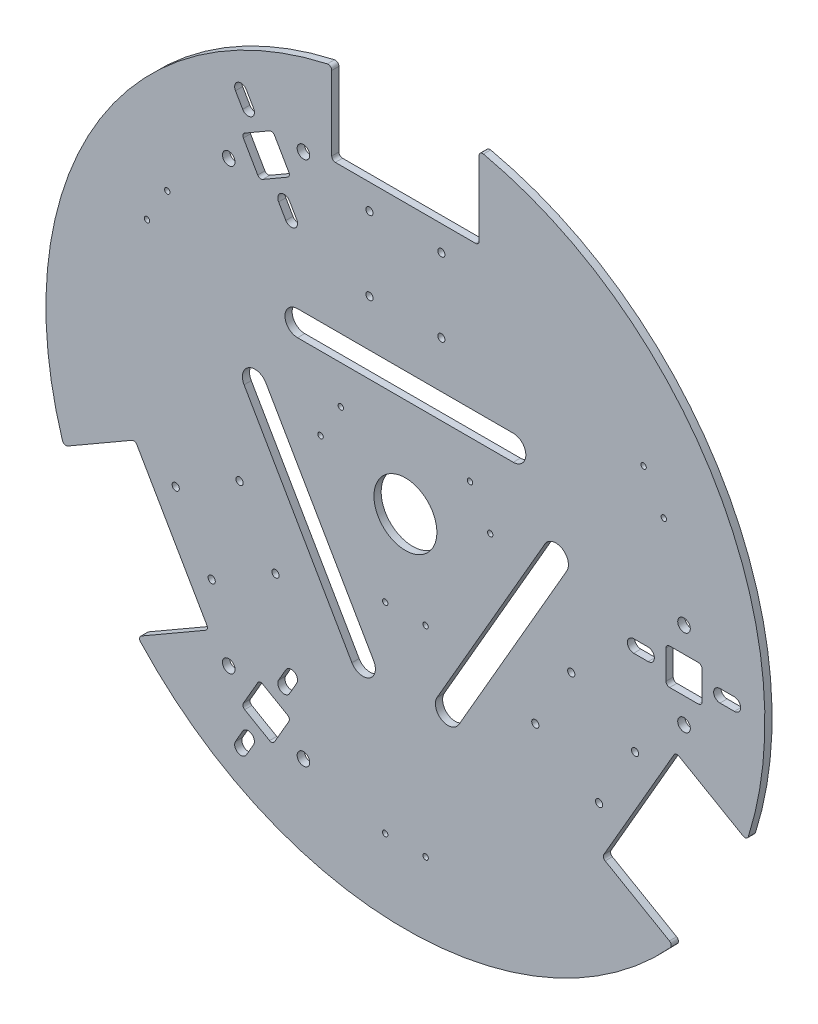
from build123d import *

# Parameters (mm, degrees)
SKETCH1_R                = 200
BOSS_EXTRUDE2_DEPTH      = 4
CUT_EXTRUDE3_DEPTH       = 4
SKETCH4_R                = 17.500000000000004
CUT_EXTRUDE4_DEPTH       = 4
SKETCH5_R                = 2
CUT_EXTRUDE5_DEPTH       = 4
SKETCH6_R                = 1.4999999999999973
SKETCH6_R_2              = 1.5000000000000042
CUT_EXTRUDE6_DEPTH       = 4
CIRPATTERN2_COUNT        = 3
CIRPATTERN3_COUNT        = 3
CUT_EXTRUDE7_DEPTH       = 4
CIRPATTERN4_COUNT        = 3
SKETCH9_R                = 3.500000000000001
SKETCH9_R_2              = 3.5000000000000075
CUT_EXTRUDE8_DEPTH       = 4
CIRPATTERN6_COUNT        = 3
FILLET1_R                = 2
FILLET2_R                = 2
CIRPATTERN7_COUNT        = 3
FILLET2_OF_CIRPATTERN7_R = 2


with BuildPart() as part:
    # Sketch1 → Boss-Extrude2 (new body)
    with BuildSketch(Plane.XY):
        Circle(SKETCH1_R)
    extrude(amount=BOSS_EXTRUDE2_DEPTH)

    # Sketch3 → Cut-Extrude3 (cut)
    with BuildSketch(Plane.XY):
        with BuildLine():
            Line((-41.00000000000001, 195.75239462136855), (-41, 150.00000000000003))
            Line((-41, 150.00000000000003), (41, 150.00000000000003))
            Line((41, 150.00000000000003), (41.00000000000001, 195.75239462136855))
            ThreePointArc((41.00000000000001, 195.75239462136855), (1.225e-14, 200), (-41.00000000000001, 195.75239462136855))
        make_face()
    cut_extrude3 = extrude(amount=CUT_EXTRUDE3_DEPTH, mode=Mode.SUBTRACT)

    # Sketch4 → Cut-Extrude4 (cut)
    with BuildSketch(Plane.XY):
        with Locations(Location((0, 0, 0), (0, 0, 180))):
            Circle(SKETCH4_R)
    extrude(amount=CUT_EXTRUDE4_DEPTH, mode=Mode.SUBTRACT)

    # Sketch5 → Cut-Extrude5 (cut)
    with BuildSketch(Plane.XY):
        with Locations(Location((-20, 136, 0), (0, 0, 180))):
            Circle(SKETCH5_R)
        with Locations(Location((-20, 95, 0), (0, 0, 180))):
            Circle(SKETCH5_R)
        with Locations(Location((20, 136, 0), (0, 0, 180))):
            Circle(SKETCH5_R)
        with Locations(Location((20, 95, 0), (0, 0, 180))):
            Circle(SKETCH5_R)
    cut_extrude5 = extrude(amount=CUT_EXTRUDE5_DEPTH, mode=Mode.SUBTRACT)

    # Sketch6 → Cut-Extrude6 (cut)
    with BuildSketch(Plane.XY):
        with Locations((-143.75605190361796, 70.00721420742511)):
            Circle(SKETCH6_R)
        with Locations((-132.50605190361796, 89.49278579257494)):
            Circle(SKETCH6_R)
        with Locations((-35.94421938165304, 33.742785792574935)):
            Circle(SKETCH6_R_2)
        with Locations((-47.19421938165304, 14.257214207425067)):
            Circle(SKETCH6_R_2)
    cut_extrude6 = extrude(amount=CUT_EXTRUDE6_DEPTH, mode=Mode.SUBTRACT)

    # CirPattern2: Cut-Extrude6 ×3 about axis
    cirpattern2_axis = Axis((9.38e-15, 1.23e-15, 0), (0, 0, 1))
    for i in range(1, CIRPATTERN2_COUNT):
        add(cut_extrude6.rotate(cirpattern2_axis, i * 360 / CIRPATTERN2_COUNT), mode=Mode.SUBTRACT)

    # CirPattern3: Cut-Extrude5 ×3 about axis
    cirpattern3_axis = Axis((6.55e-15, -6.68e-15, 0), (0, 0, 1))
    for i in range(1, CIRPATTERN3_COUNT):
        add(cut_extrude5.rotate(cirpattern3_axis, i * 360 / CIRPATTERN3_COUNT), mode=Mode.SUBTRACT)

    # Sketch8 → Cut-Extrude7 (cut)
    with BuildSketch(Plane.XY):
        with BuildLine():
            Line((-60, 69), (60, 69.00000000000003))
            ThreePointArc((60, 69.00000000000003), (66.99999999999997, 62), (60, 55.00000000000002))
            Line((60, 55.00000000000002), (-60, 55))
            ThreePointArc((-60, 55), (-67, 62), (-60, 69))
        make_face()
    cut_extrude7 = extrude(amount=CUT_EXTRUDE7_DEPTH, mode=Mode.SUBTRACT)

    # CirPattern4: Cut-Extrude7 ×3 about axis
    cirpattern4_axis = Axis((2.08e-15, -4.82e-15, 0), (0, 0, 1))
    for i in range(1, CIRPATTERN4_COUNT):
        add(cut_extrude7.rotate(cirpattern4_axis, i * 360 / CIRPATTERN4_COUNT), mode=Mode.SUBTRACT)

    # Sketch9 → Cut-Extrude8 (cut)
    with BuildSketch(Plane.XY.offset(4)):
        with Locations((-56.71539030917355, 146.233937586588)):
            Circle(SKETCH9_R)
        with Locations((-98.28460969082658, 122.23393758658793)):
            Circle(SKETCH9_R_2)
        Polygon((-91.16025403784447, 137.89419162443235), (-81.16025403784445, 120.57368354874356), (-63.83974596215569, 130.57368354874362), (-73.8397459621557, 147.89419162443235), align=None)
        with BuildLine():
            Line((-64.46891108675452, 118.66342951089922), (-60.46891108675456, 111.73522628062365))
            ThreePointArc((-60.46891108675456, 111.73522628062365), (-61.75000000000001, 106.9541373673781), (-66.53108891324563, 108.23522628062368))
            Line((-66.53108891324563, 108.23522628062368), (-70.53108891324557, 115.1634295108992))
            ThreePointArc((-70.53108891324557, 115.1634295108992), (-69.25000000000003, 119.94451842414472), (-64.46891108675452, 118.66342951089922))
        make_face()
        with BuildLine():
            Line((-84.46891108675456, 153.30444566227675), (-88.46891108675459, 160.23264889255222))
            ThreePointArc((-88.46891108675459, 160.23264889255222), (-93.25000000000009, 161.5137378057978), (-94.53108891324563, 156.73264889255222))
            Line((-94.53108891324563, 156.73264889255222), (-90.53108891324563, 149.80444566227675))
            ThreePointArc((-90.53108891324563, 149.80444566227675), (-85.7500000000001, 148.52335674903122), (-84.46891108675456, 153.30444566227675))
        make_face()
    cut_extrude8 = extrude(amount=-CUT_EXTRUDE8_DEPTH, mode=Mode.SUBTRACT)

    # CirPattern6: Cut-Extrude3 ×3 about axis
    cirpattern6_axis = Axis((-9.9e-16, -1.19e-14, 0), (0, 0, 1))
    for i in range(1, CIRPATTERN6_COUNT):
        add(cut_extrude3.rotate(cirpattern6_axis, i * 360 / CIRPATTERN6_COUNT), mode=Mode.SUBTRACT)

    # Fillet1
    fillet1_edges = [part.edges().sort_by_distance(p)[0] for p in [
        (41.00000000000001, 195.75239462136855, 2),
        (-41.00000000000001, 195.75239462136855, 2),
        (-41, 150.00000000000003, 2),
        (41, 150.00000000000003, 2),
        (149.0265465937414, -133.38323886584638, 2),
        (190.02654659374144, -62.36915575552241, 2),
        (150.4038105676658, -39.49295844483813, 2),
        (109.40381056766577, -110.50704155516208, 2),
        (-190.0265465937415, -62.36915575552226, 2),
        (-149.0265465937415, -133.38323886584627, 2),
        (-109.40381056766586, -110.50704155516199, 2),
        (-150.40381056766583, -39.49295844483801, 2),
    ]]
    fillet(fillet1_edges, radius=FILLET1_R)

    # Fillet2
    fillet2_edges = [part.edges().sort_by_distance(p)[0] for p in [
        (-91.16025403784447, 137.89419162443235, 2),
        (-73.8397459621557, 147.89419162443235, 2),
        (-63.83974596215569, 130.57368354874362, 2),
        (-81.16025403784445, 120.57368354874356, 2),
    ]]
    fillet(fillet2_edges, radius=FILLET2_R)

    # CirPattern7: Cut-Extrude8 ×3 about axis
    cirpattern7_axis = Axis((8.29e-15, -5.06e-15, 0), (0, 0, 1))
    for i in range(1, CIRPATTERN7_COUNT):
        add(cut_extrude8.rotate(cirpattern7_axis, i * 360 / CIRPATTERN7_COUNT), mode=Mode.SUBTRACT)

    # Fillet2 of CirPattern7
    fillet2_of_cirpattern7_edges = [part.edges().sort_by_distance(p)[0] for p in [
        (-73.83974596215556, -147.89419162443244, 2),
        (-91.16025403784433, -137.89419162443244, 2),
        (-81.16025403784437, -120.57368354874366, 2),
        (-63.83974596215556, -130.57368354874365, 2),
        (165.00000000000006, 10, 2),
        (165.00000000000003, -10, 2),
        (145.00000000000009, -10.000000000000014, 2),
        (145.00000000000003, 10, 2),
    ]]
    fillet(fillet2_of_cirpattern7_edges, radius=FILLET2_OF_CIRPATTERN7_R)


solid = part.part
